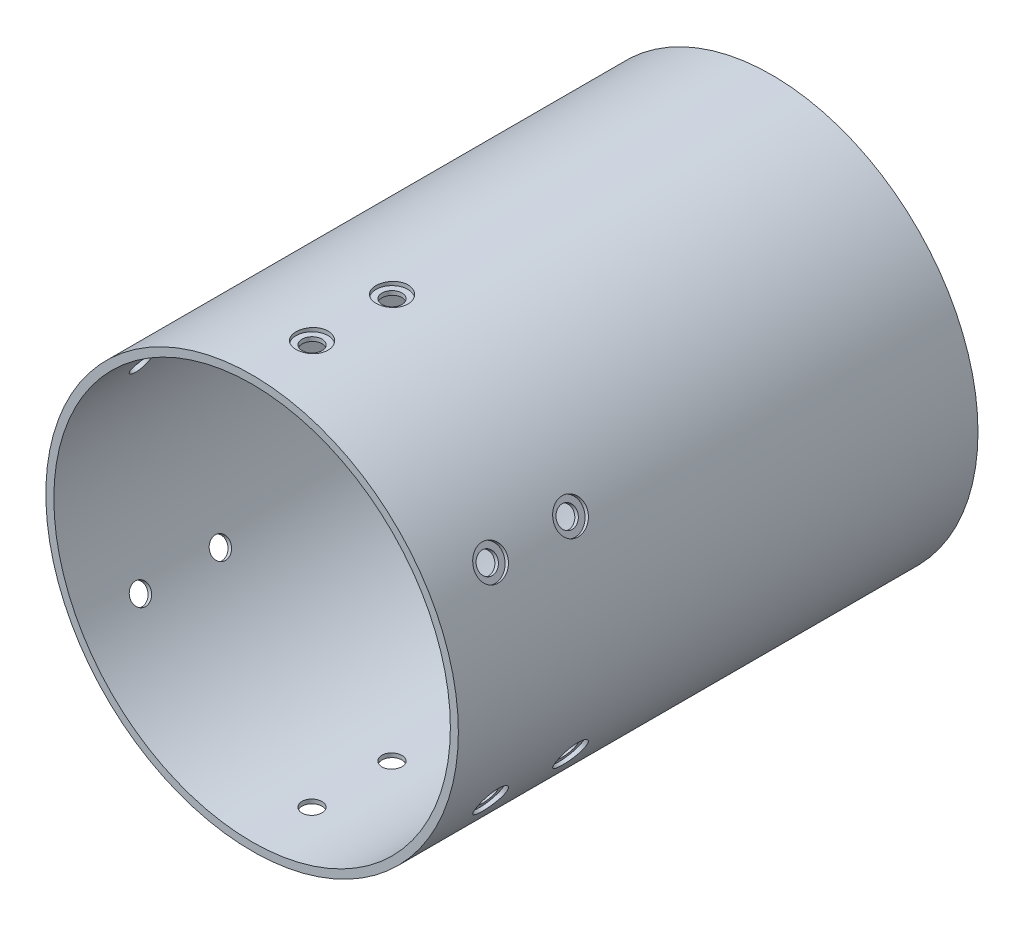
from build123d import *

# Parameters (mm, degrees)
SKETCH1_R           = 51.6
SKETCH1_R_2         = 49.6
BOSS_EXTRUDE1_DEPTH = 130
SKETCH2_R           = 4
CUT_EXTRUDE1_DEPTH  = 1
SKETCH3_R           = 2.5
CUT_EXTRUDE2_DEPTH  = 3
CIRPATTERN1_COUNT   = 6


with BuildPart() as part:
    # Sketch1 → Boss-Extrude1 (new body)
    with BuildSketch(Plane.XY):
        Circle(SKETCH1_R)
        Circle(SKETCH1_R_2, mode=Mode.SUBTRACT)
    extrude(amount=BOSS_EXTRUDE1_DEPTH)

    # Sketch2 → Cut-Extrude1 (cut)
    with BuildSketch(Plane(origin=(0, -51.6, 0), x_dir=(-1, 0, 0), z_dir=(0, -1, 0))):
        with Locations(Location((0, -95, 0), (0, 0, 90))):
            Circle(SKETCH2_R)
        with Locations(Location((0, -115, 0), (0, 0, 90))):
            Circle(SKETCH2_R)
    cut_extrude1 = extrude(amount=-CUT_EXTRUDE1_DEPTH, mode=Mode.SUBTRACT)

    # Sketch3 → Cut-Extrude2 (cut)
    with BuildSketch(Plane(origin=(0, -51.6, 0), x_dir=(-1, 0, 0), z_dir=(0, -1, 0))):
        with Locations(Location((0, -95, 0), (0, 0, 90))):
            Circle(SKETCH3_R)
        with Locations(Location((0, -115, 0), (0, 0, 90))):
            Circle(SKETCH3_R)
    cut_extrude2 = extrude(amount=-CUT_EXTRUDE2_DEPTH, mode=Mode.SUBTRACT)

    # CirPattern1: Cut-Extrude1, Cut-Extrude2 ×6 about axis
    cirpattern1_axis = Axis((0, 0, 0), (0, 0, 1))
    add([cut_extrude1.rotate(cirpattern1_axis, i * 360 / CIRPATTERN1_COUNT) for i in range(1, CIRPATTERN1_COUNT)], mode=Mode.SUBTRACT)
    add([cut_extrude2.rotate(cirpattern1_axis, i * 360 / CIRPATTERN1_COUNT) for i in range(1, CIRPATTERN1_COUNT)], mode=Mode.SUBTRACT)


solid = part.part
